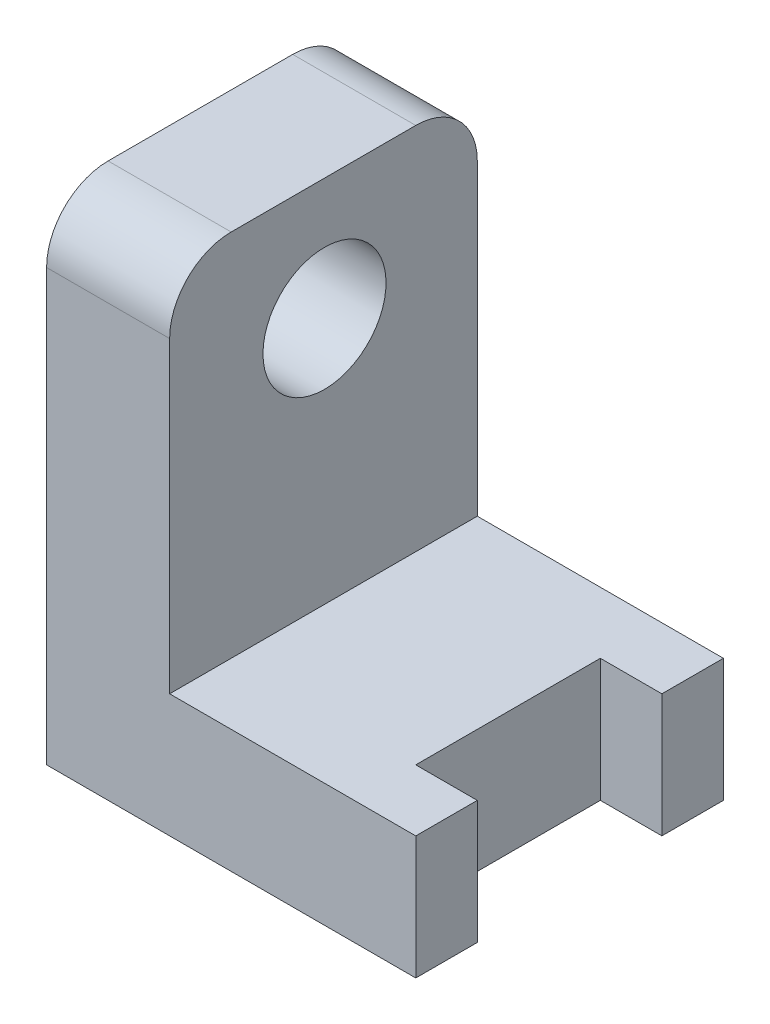
from build123d import *

# Parameters (mm, degrees)
ESTRUSIONE_ESTRUSIONE1_DEPTH = 12.5
TAGLIO_ESTRUSIONE1_REACH     = 46.23
SCHIZZO3_W                   = 5
SCHIZZO3_H                   = 15
FORO_10_0_10_1_D             = 10
RACCORDO1_R                  = 5


with BuildPart() as part:
    # Schizzo1 → Estrusione-Estrusione1 (new, symmetric)
    with BuildSketch(Plane.XY):
        Polygon((0, 40), (0, 0), (30, 0), (30, 10), (10, 10), (10, 40), align=None)
    extrude(amount=ESTRUSIONE_ESTRUSIONE1_DEPTH, both=True)

    # Schizzo3 → Taglio-Estrusione1 (cut, up to next)
    with BuildSketch(Plane(origin=(0, 10, 0), x_dir=(1, 0, 0), z_dir=(0, 1, 0)), mode=Mode.PRIVATE) as taglio_estrusione1_sk1:
        with Locations((27.5, 0)):
            Rectangle(SCHIZZO3_W, SCHIZZO3_H)
    taglio_estrusione1_tool1 = extrude(taglio_estrusione1_sk1.sketch, amount=-TAGLIO_ESTRUSIONE1_REACH, mode=Mode.PRIVATE) & part.part
    add(taglio_estrusione1_tool1.solids().sort_by_distance((27.5, 10, 0))[0], mode=Mode.SUBTRACT)

    # Foro Ø10.0 (10)-1 (through all)
    with Locations(Plane(origin=(0, 30.13078981, -0.0833926), x_dir=(0, -1, 0), z_dir=(-1, 0, 0))):
        with Locations((0, 0)):
            Hole(FORO_10_0_10_1_D / 2)

    # Raccordo1
    raccordo1_edges = [part.edges().sort_by_distance(p)[0] for p in [
        (5, 40, 12.5),
        (5, 40, -12.5),
    ]]
    fillet(raccordo1_edges, radius=RACCORDO1_R)


solid = part.part
